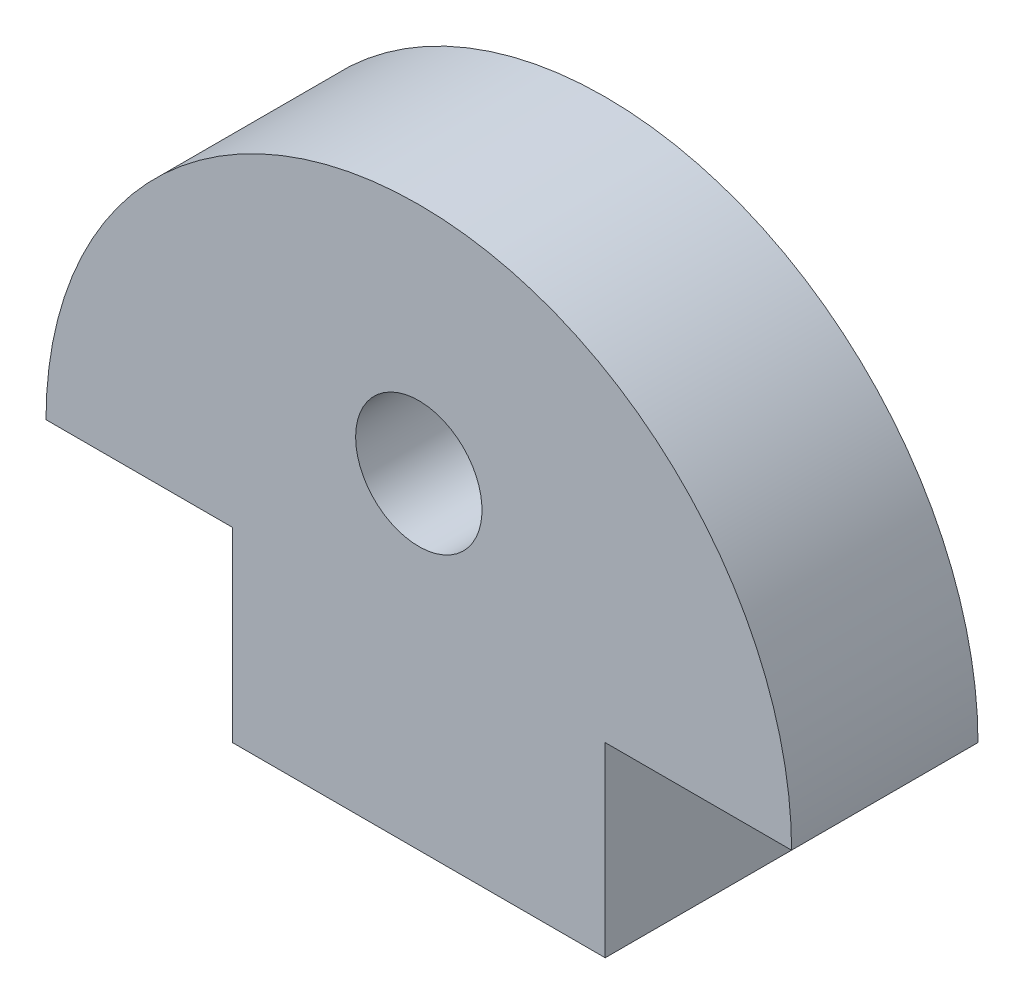
from build123d import *

# Parameters (mm, degrees)
BASE_DEPTH          = 6.35
AXLE_HOLE_D         = 4.3053
SKETCH8_W           = 12.7
SKETCH8_H           = 6.35
BOSS_EXTRUDE2_DEPTH = 6.35


with BuildPart() as part:
    # Sketch1 → Base (new body)
    with BuildSketch(Plane.XY):
        with BuildLine():
            Line((-12.7, -12.7), (12.7, -12.7))
            ThreePointArc((12.7, -12.7), (0, 0), (-12.7, -12.7))
        make_face()
    extrude(amount=BASE_DEPTH)

    # Axle hole (through all)
    with Locations(Plane(origin=(0, 0, 0), x_dir=(-1, 0, 0), z_dir=(0, 0, -1))):
        with Locations((0, -7.9375)):
            Hole(AXLE_HOLE_D / 2)

    # Sketch8 → Boss-Extrude2 (add)
    with BuildSketch(Plane.XY.offset(6.35)):
        with Locations((0, -15.875)):
            Rectangle(SKETCH8_W, SKETCH8_H)
    extrude(amount=-BOSS_EXTRUDE2_DEPTH)


solid = part.part
